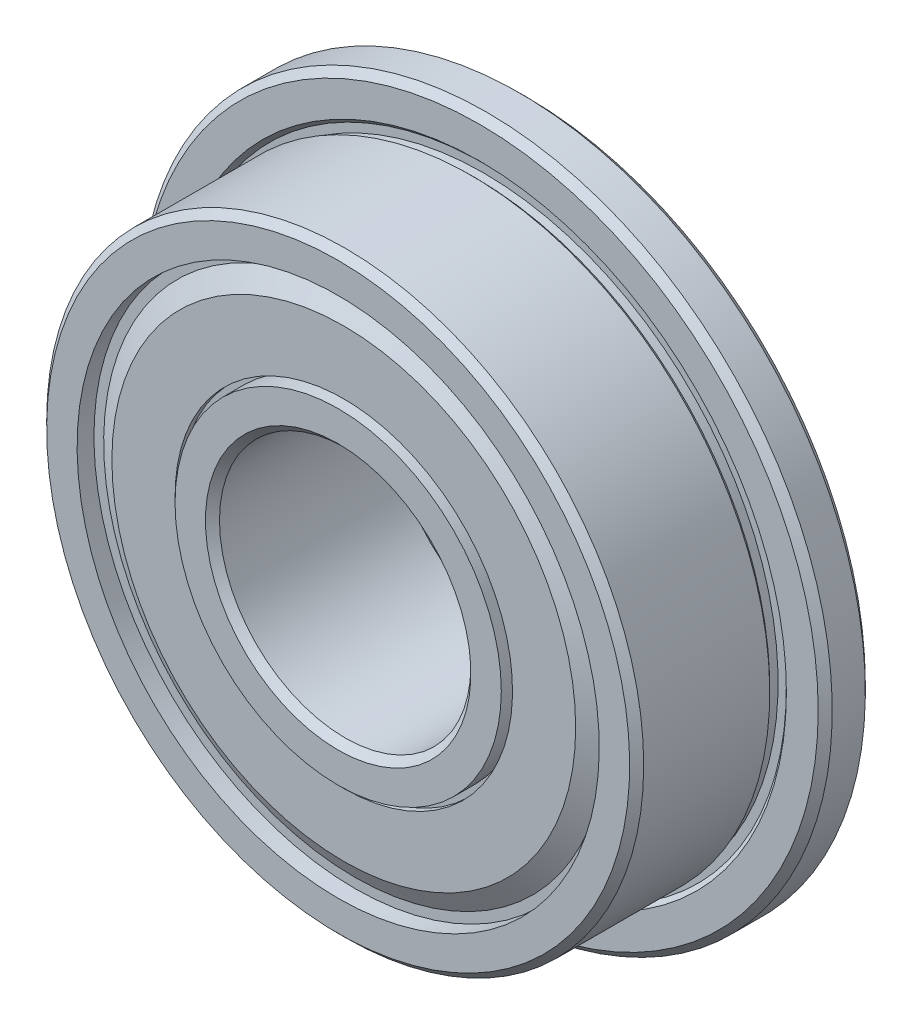
from build123d import *

# Parameters (mm, degrees)
FILLET1_SIZE      = 0.2234375
FILLET2_SIZE      = 0.2234375
CIRPATTERN3_COUNT = 9
SKETCH8_W         = 0.715
SKETCH8_H         = 0.595833333


with BuildPart() as part:
    # Sketch2 → Revolve1 (revolve)
    with BuildSketch(Plane(origin=(0, 0, 0), x_dir=(0, 0, -1), z_dir=(1, 0, 0)), mode=Mode.PRIVATE) as revolve1_sk:
        with BuildLine():
            Line((3, 11), (1.5, 11))
            Line((1.5, 11), (1.5, 9.765165043))
            Line((1.5, 9.765165043), (1.632582521, 9.632582521))
            Line((1.632582521, 9.632582521), (1.632582521, 9.367417479))
            Line((1.632582521, 9.367417479), (1.367417479, 9.367417479))
            Line((1.367417479, 9.367417479), (1.234834957, 9.5))
            Line((1.234834957, 9.5), (-3, 9.5))
            Line((-3, 9.5), (-3, 7.7125))
            Line((-3, 7.7125), (-1.262438117, 7.7125))
            ThreePointArc((-1.262438117, 7.7125), (0, 8.3375), (1.262438117, 7.7125))
            Line((1.262438117, 7.7125), (3, 7.7125))
            Line((3, 7.7125), (3, 11))
        make_face()
        with BuildLine():
            Line((3, 4), (-3, 4))
            Line((-3, 4), (-3, 5.7875))
            Line((-3, 5.7875), (-1.262438117, 5.7875))
            ThreePointArc((-1.262438117, 5.7875), (0, 5.1625), (1.262438117, 5.7875))
            Line((1.262438117, 5.7875), (3, 5.7875))
            Line((3, 5.7875), (3, 4))
        make_face()
    revolve(revolve1_sk.sketch.rotate(Axis((0, 0, 0), (0, 0, -1)), 180), axis=Axis((0, 0, 0), (0, 0, -1)))

    # Fillet1
    fillet1_edges = [part.edges().sort_by_distance(p)[0] for p in [
        (0, 9.5, 3),
        (0, 11, -3),
        (0, 11, -1.5),
    ]]
    chamfer(fillet1_edges, length=FILLET1_SIZE)

    # Fillet2
    fillet2_edges = [part.edges().sort_by_distance(p)[0] for p in [
        (0, 4, -3),
        (0, 4, 3),
    ]]
    chamfer(fillet2_edges, length=FILLET2_SIZE)

    # Sketch8 → Cut-Revolve1 (revolve, cut)
    with BuildSketch(Plane(origin=(0, 0, 0), x_dir=(0, 0, -1), z_dir=(1, 0, 0)), mode=Mode.PRIVATE) as cut_revolve1_sk:
        with Locations((-2.6425, 8.010416666)):
            Rectangle(SKETCH8_W, SKETCH8_H)
        with Locations((2.6425, 8.010416666)):
            Rectangle(SKETCH8_W, SKETCH8_H)
        with Locations((2.6425, 5.489583334)):
            Rectangle(SKETCH8_W, SKETCH8_H)
        with Locations((-2.6425, 5.489583334)):
            Rectangle(SKETCH8_W, SKETCH8_H)
    revolve(cut_revolve1_sk.sketch.rotate(Axis((0, 0, 0), (0, 0, -1)), 180), axis=Axis((0, 0, 0), (0, 0, -1)), mode=Mode.SUBTRACT)


with BuildPart() as body_2:
    # Sketch7 → Revolve3 (revolve)
    with BuildSketch(Plane.XY):
        with BuildLine():
            Line((0, 8.3375), (0, 5.1625))
            ThreePointArc((0, 5.1625), (-1.5875, 6.75), (0, 8.3375))
        make_face()
    revolve(axis=Axis((0, 8.3375, 0), (0, -1, 0)))


with BuildPart() as cirpattern3_1:
    # CirPattern3: pattern copy
    add(body_2.part.rotate(Axis((0, 0, 0), (0, 0, 1)), 1 * 360 / CIRPATTERN3_COUNT))


with BuildPart() as cirpattern3_2:
    # CirPattern3: pattern copy
    add(body_2.part.rotate(Axis((0, 0, 0), (0, 0, 1)), 2 * 360 / CIRPATTERN3_COUNT))


with BuildPart() as cirpattern3_3:
    # CirPattern3: pattern copy
    add(body_2.part.rotate(Axis((0, 0, 0), (0, 0, 1)), 3 * 360 / CIRPATTERN3_COUNT))


with BuildPart() as cirpattern3_4:
    # CirPattern3: pattern copy
    add(body_2.part.rotate(Axis((0, 0, 0), (0, 0, 1)), 4 * 360 / CIRPATTERN3_COUNT))


with BuildPart() as cirpattern3_5:
    # CirPattern3: pattern copy
    add(body_2.part.rotate(Axis((0, 0, 0), (0, 0, 1)), 5 * 360 / CIRPATTERN3_COUNT))


with BuildPart() as cirpattern3_6:
    # CirPattern3: pattern copy
    add(body_2.part.rotate(Axis((0, 0, 0), (0, 0, 1)), 6 * 360 / CIRPATTERN3_COUNT))


with BuildPart() as cirpattern3_7:
    # CirPattern3: pattern copy
    add(body_2.part.rotate(Axis((0, 0, 0), (0, 0, 1)), 7 * 360 / CIRPATTERN3_COUNT))


with BuildPart() as cirpattern3_8:
    # CirPattern3: pattern copy
    add(body_2.part.rotate(Axis((0, 0, 0), (0, 0, 1)), 8 * 360 / CIRPATTERN3_COUNT))


with BuildPart() as body_11:
    # Sketch9 → Revolve4 (revolve)
    with BuildSketch(Plane(origin=(0, 0, 0), x_dir=(0, 0, -1), z_dir=(1, 0, 0)), mode=Mode.PRIVATE) as revolve4_sk:
        Polygon((-2.285, 8.308333333), (-2.285, 7.951190476), (-2.6425, 7.331982312), (-2.6425, 5.370416667), (-2.82125, 5.370416667), (-2.82125, 7.379878231), (-2.46375, 7.999086394), (-2.46375, 8.308333333), align=None)
        Polygon((2.285, 8.308333333), (2.285, 7.951190476), (2.6425, 7.331982312), (2.6425, 5.370416667), (2.82125, 5.370416667), (2.82125, 7.379878231), (2.46375, 7.999086394), (2.46375, 8.308333333), align=None)
    revolve(revolve4_sk.sketch.rotate(Axis((0, 0, 0), (0, 0, -1)), 180), axis=Axis((0, 0, 0), (0, 0, -1)))


solid = Compound([part.part, body_2.part, cirpattern3_1.part, cirpattern3_2.part, cirpattern3_3.part, cirpattern3_4.part, cirpattern3_5.part, cirpattern3_6.part, cirpattern3_7.part, cirpattern3_8.part, body_11.part])
